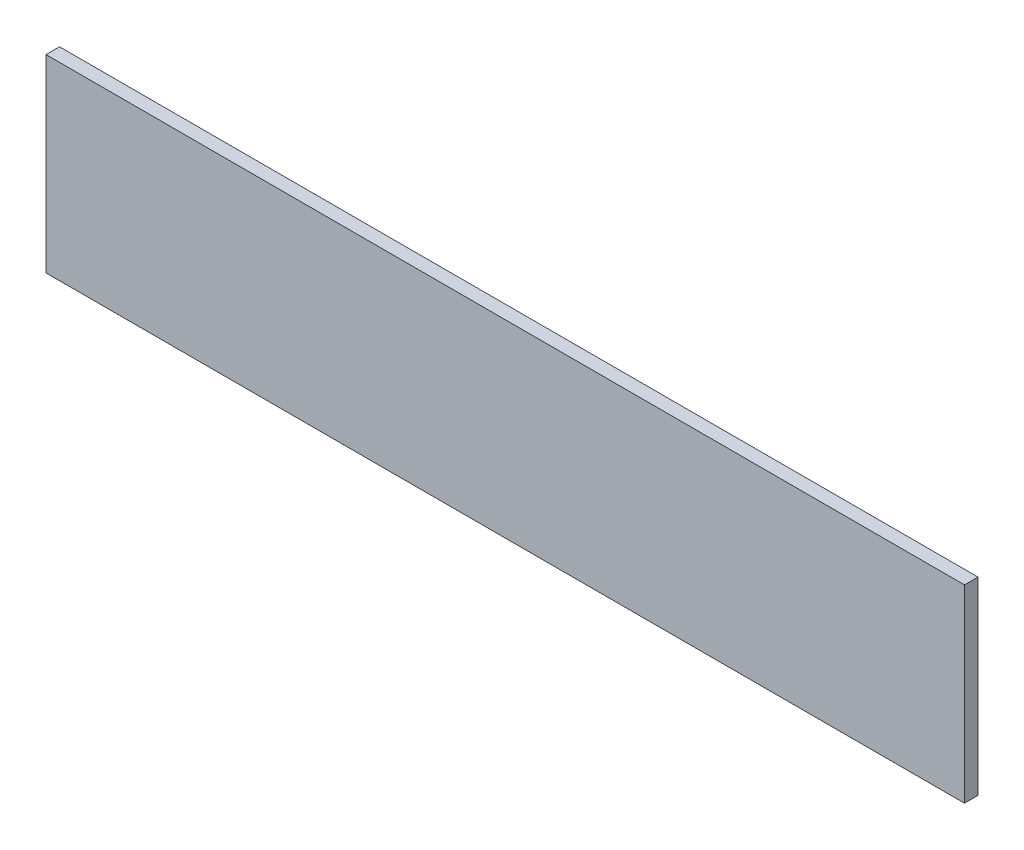
from build123d import *

# Parameters (mm, degrees)
SKETCH1_W           = 863.6
SKETCH1_H           = 177.8
BOSS_EXTRUDE1_DEPTH = 12.7
SKETCH2_R           = 3.175
CUT_EXTRUDE3_DEPTH  = 11.43
SKETCH3_R           = 2.5
CUT_EXTRUDE4_DEPTH  = 8
SKETCH5_R           = 2.5
CUT_EXTRUDE6_DEPTH  = 8
SKETCH6_R           = 3.175
CUT_EXTRUDE7_DEPTH  = 11.43


with BuildPart() as part:
    # Sketch1 → Boss-Extrude1 (new body)
    with BuildSketch(Plane.XY):
        Rectangle(SKETCH1_W, SKETCH1_H)
    extrude(amount=BOSS_EXTRUDE1_DEPTH)

    # Sketch2 → Cut-Extrude3 (cut)
    with BuildSketch(Plane.XY):
        with Locations((-425.45, 0)):
            Circle(SKETCH2_R)
        with Locations(Location((425.45, 0, 0), (0, 0, 180))):
            Circle(SKETCH2_R)
    extrude(amount=CUT_EXTRUDE3_DEPTH, mode=Mode.SUBTRACT)

    # Sketch3 → Cut-Extrude4 (cut)
    with BuildSketch(Plane(origin=(0, 0, 0), x_dir=(-1, 0, 0), z_dir=(0, 0, -1))):
        with Locations((-425.45, 44.45)):
            Circle(SKETCH3_R)
        with Locations(Location((425.45, 44.45, 0), (0, 0, 180))):
            Circle(SKETCH3_R)
        with Locations((425.45, -44.45)):
            Circle(SKETCH3_R)
        with Locations(Location((-425.45, -44.45, 0), (0, 0, 180))):
            Circle(SKETCH3_R)
    extrude(amount=-CUT_EXTRUDE4_DEPTH, mode=Mode.SUBTRACT)

    # Sketch5 → Cut-Extrude6 (cut)
    with BuildSketch(Plane(origin=(0, 0, 0), x_dir=(-1, 0, 0), z_dir=(0, 0, -1))):
        with Locations((-425.45, -82.55)):
            Circle(SKETCH5_R)
        with Locations((-212.725, -82.55)):
            Circle(SKETCH5_R)
        with Locations((0, -82.55)):
            Circle(SKETCH5_R)
        with Locations((212.725, -82.55)):
            Circle(SKETCH5_R)
        with Locations((425.45, -82.55)):
            Circle(SKETCH5_R)
    extrude(amount=-CUT_EXTRUDE6_DEPTH, mode=Mode.SUBTRACT)

    # Sketch6 → Cut-Extrude7 (cut)
    with BuildSketch(Plane(origin=(0, 0, 0), x_dir=(-1, 0, 0), z_dir=(0, 0, -1))):
        with Locations((-319.0875, -82.55)):
            Circle(SKETCH6_R)
        with Locations((-106.3625, -82.55)):
            Circle(SKETCH6_R)
        with Locations((106.3625, -82.55)):
            Circle(SKETCH6_R)
        with Locations((319.0875, -82.55)):
            Circle(SKETCH6_R)
    extrude(amount=-CUT_EXTRUDE7_DEPTH, mode=Mode.SUBTRACT)


solid = part.part
